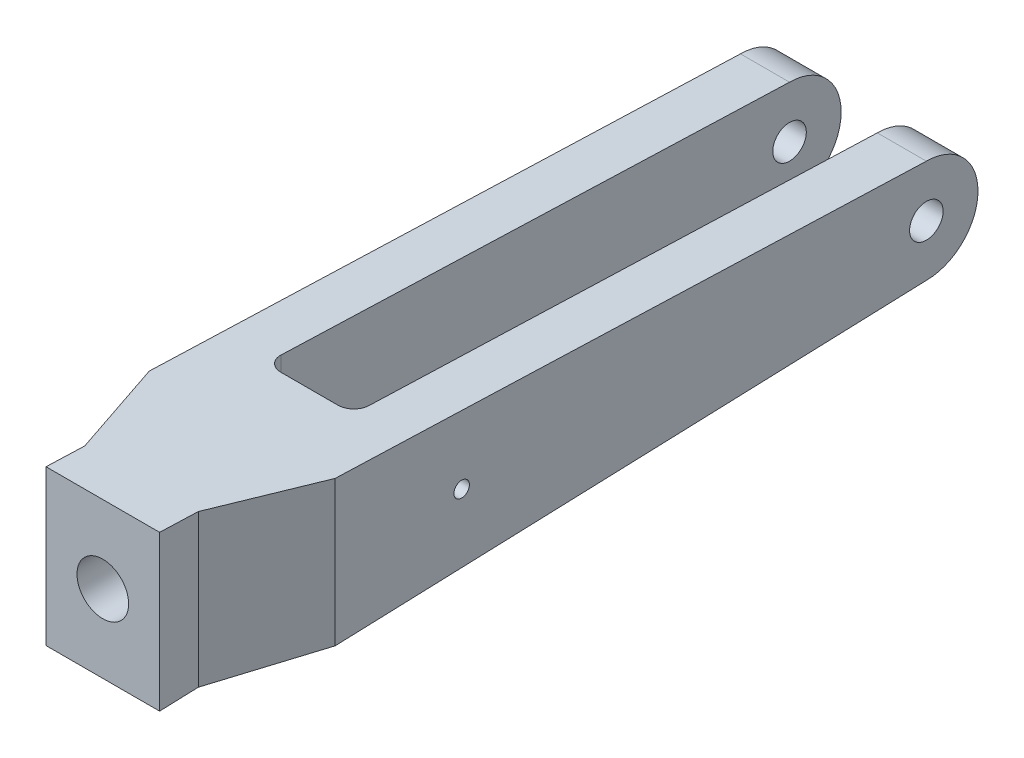
from build123d import *

# Parameters (mm, degrees)
BOSS_EXTRUDE1_DEPTH = 30
SKETCH3_R           = 1.5
SKETCH3_R_2         = 3.25
CUT_EXTRUDE2_DEPTH  = 100
FILLET1_R           = 3
SKETCH6_R           = 5
CUT_EXTRUDE3_DEPTH  = 30


with BuildPart() as part:
    # Sketch1 → Boss-Extrude1 (new body)
    with BuildSketch(Plane(origin=(0, 0, 0), x_dir=(1, 0, 0), z_dir=(0, 1, 0))):
        Polygon((-7.001251561, 151.499010634), (2.498748439, 151.499010634), (2.498748439, 39.999010634), (19.498748439, 39.999010634), (19.498748439, 151.499010634), (28.998748439, 151.499010634), (28.998748439, 26.999010634), (21.998748439, 7.499010634), (21.998748439, -0.000989366), (-0.001251561, -0.000989366), (-0.001251561, 7.499010634), (-7.001251561, 26.999010634), align=None)
    extrude(amount=BOSS_EXTRUDE1_DEPTH)

    # Sketch3 → Cut-Extrude2 (cut)
    with BuildSketch(Plane(origin=(28.998748439, 0, 0), x_dir=(0, 0, -1), z_dir=(1, 0, 0))):
        with BuildLine():
            Line((26.999010634, 30), (26.999010634, 29.045936396))
            Line((26.999010634, 29.045936396), (141.499010634, 25))
            ThreePointArc((141.499010634, 25), (148.570078446, 22.071067812), (151.499010634, 15))
            Line((151.499010634, 15), (151.499010634, 30))
            Line((151.499010634, 30), (26.999010634, 30))
        make_face()
        with BuildLine():
            Line((141.499010634, 5), (26.999010634, 0.954063604))
            Line((26.999010634, 0.954063604), (26.999010634, 0))
            Line((26.999010634, 0), (151.499010634, 0))
            Line((151.499010634, 0), (151.499010634, 15))
            ThreePointArc((151.499010634, 15), (148.570078446, 7.928932188), (141.499010634, 5))
        make_face()
        Polygon((26.999010634, 30), (-0.000989366, 30), (26.999010634, 29.045936396), align=None)
        Polygon((26.999010634, 0.954063604), (-0.000989366, 0), (26.999010634, 0), align=None)
        with Locations((51.499010634, 15)):
            Circle(SKETCH3_R)
        with Locations((141.499010634, 15)):
            Circle(SKETCH3_R_2)
    extrude(amount=-CUT_EXTRUDE2_DEPTH, mode=Mode.SUBTRACT)

    # Fillet1
    fillet1_edges = [part.edges().sort_by_distance(p)[0] for p in [
        (2.498748439, 15, -39.999010634),
        (19.498748439, 15, -39.999010634),
    ]]
    fillet(fillet1_edges, radius=FILLET1_R)

    # Sketch6 → Cut-Extrude3 (cut)
    with BuildSketch(Plane.XY.offset(0.000989366)):
        with Locations((10.998748439, 15)):
            Circle(SKETCH6_R)
    extrude(amount=-CUT_EXTRUDE3_DEPTH, mode=Mode.SUBTRACT)


solid = part.part
